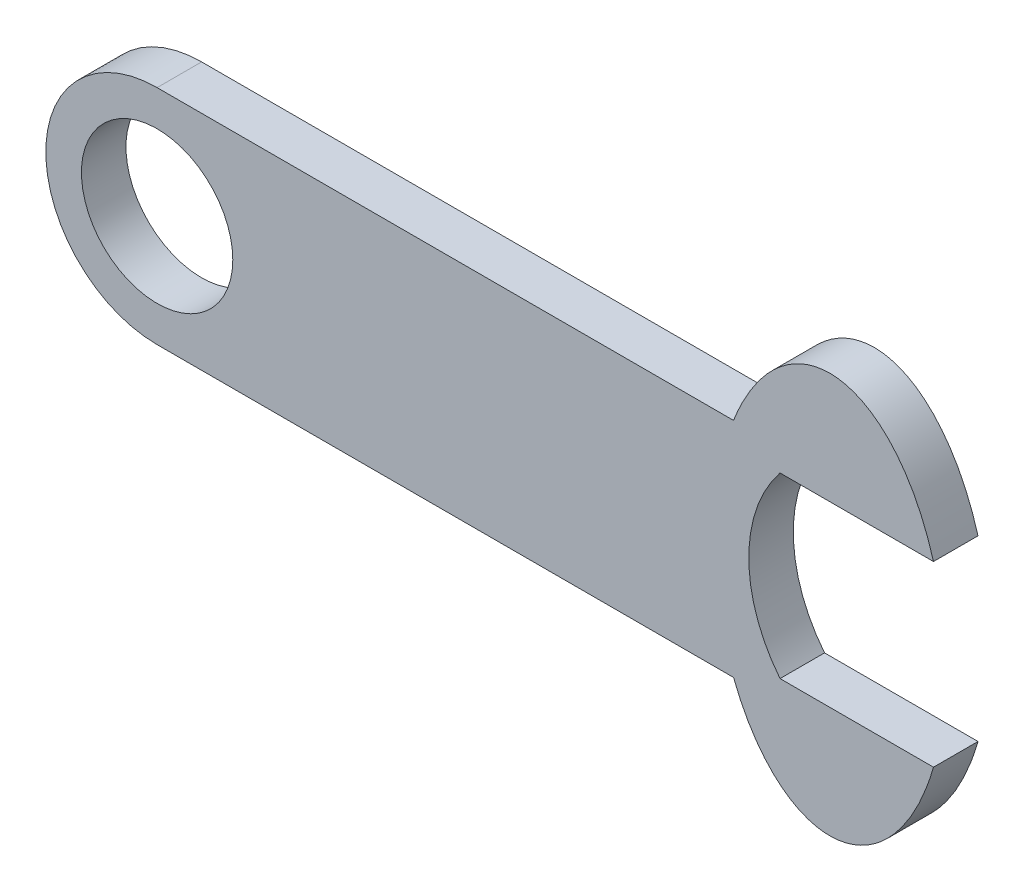
from build123d import *

# Parameters (mm, degrees)
IZIM1_R                     = 17
Y_KSEKLIK_EKSTR_ZYON1_DEPTH = 10


with BuildPart() as part:
    # Çizim1 → Yükseklik-Ekstrüzyon1 (new body)
    with BuildSketch(Plane.XY):
        with BuildLine():
            Line((-50.538386463, 25), (78.943148636, 25))
            add(Edge.make_bspline(
                [(123.852580365, 20), (103.89283293, 89.629118064), (78.943148636, 25)],
                knots=[5.172942972, 5.172942972, 5.172942972, 7.264950664, 7.264950664, 7.264950664], degree=2, weights=[1, 0.501033423, 1]))
            Line((123.852580365, 20), (89.381621543, 20))
            ThreePointArc((89.381621543, 20), (82.361613537, 0), (89.381621543, -20))
            Line((89.381621543, -20), (123.852580365, -20))
            add(Edge.make_bspline(
                [(78.943148636, -25), (103.89283293, -89.629118064), (123.852580365, -20)],
                knots=[2.159827297, 2.159827297, 2.159827297, 4.251834989, 4.251834989, 4.251834989], degree=2, weights=[1, 0.501033423, 1]))
            Line((78.943148636, -25), (-50.538386463, -25))
            ThreePointArc((-50.538386463, -25), (-75.538386463, 0), (-50.538386463, 25))
        make_face()
        with Locations((-50.538386463, 0)):
            Circle(IZIM1_R, mode=Mode.SUBTRACT)
    extrude(amount=Y_KSEKLIK_EKSTR_ZYON1_DEPTH)


solid = part.part
